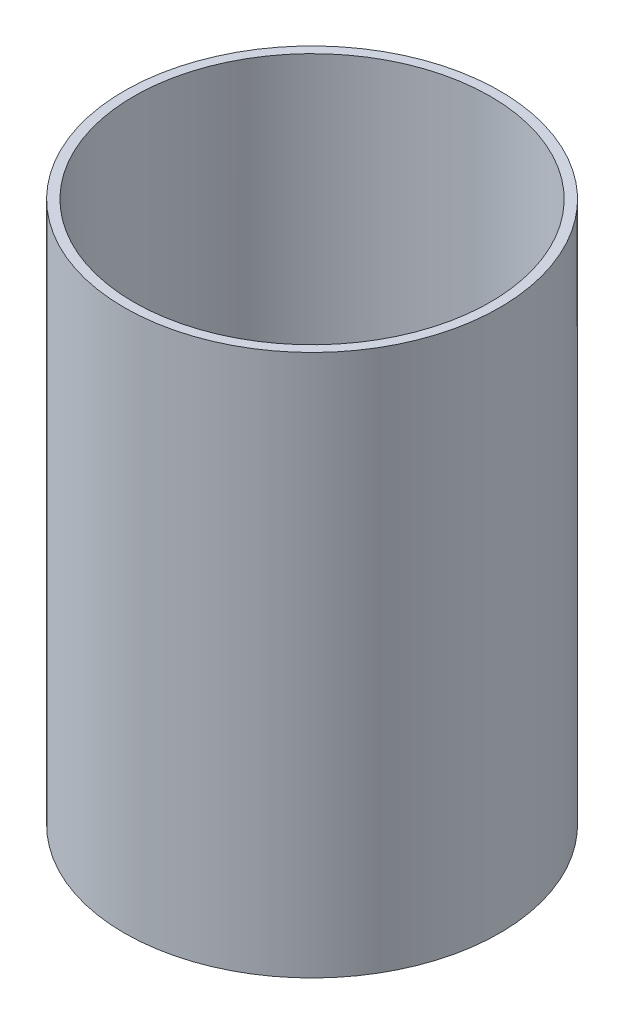
from build123d import *

# Parameters (mm, degrees)
SKETCH1_R           = 50.546
SKETCH1_R_2         = 48.006
BOSS_EXTRUDE1_DEPTH = 145.8595
SKETCH2_R           = 50.546
BOSS_EXTRUDE2_DEPTH = 1.9812
SKETCH3_R           = 14.605
CUT_EXTRUDE1_DEPTH  = 161.657279458


with BuildPart() as part:
    # Sketch1 → Boss-Extrude1 (new body)
    with BuildSketch(Plane(origin=(0, 0, 0), x_dir=(1, 0, 0), z_dir=(0, 1, 0))):
        with Locations(Location((0, 0, 0), (0, 0, 270))):
            Circle(SKETCH1_R)
        with Locations(Location((0, 0, 0), (0, 0, 270))):
            Circle(SKETCH1_R_2, mode=Mode.SUBTRACT)
    extrude(amount=BOSS_EXTRUDE1_DEPTH)

    # Sketch2 → Boss-Extrude2 (add)
    with BuildSketch(Plane.XZ):
        with Locations(Location((0, 0, 0), (0, 0, 90))):
            Circle(SKETCH2_R)
    extrude(amount=-BOSS_EXTRUDE2_DEPTH)

    # Sketch3 → Cut-Extrude1 (cut, through all)
    with BuildSketch(Plane(origin=(0, 1.9812, 0), x_dir=(-1, 0, 0), z_dir=(0, 1, 0))):
        with Locations(Location((0, 28.575, 0), (0, 0, 90))):
            Circle(SKETCH3_R)
    extrude(amount=-CUT_EXTRUDE1_DEPTH, mode=Mode.SUBTRACT)


solid = part.part
